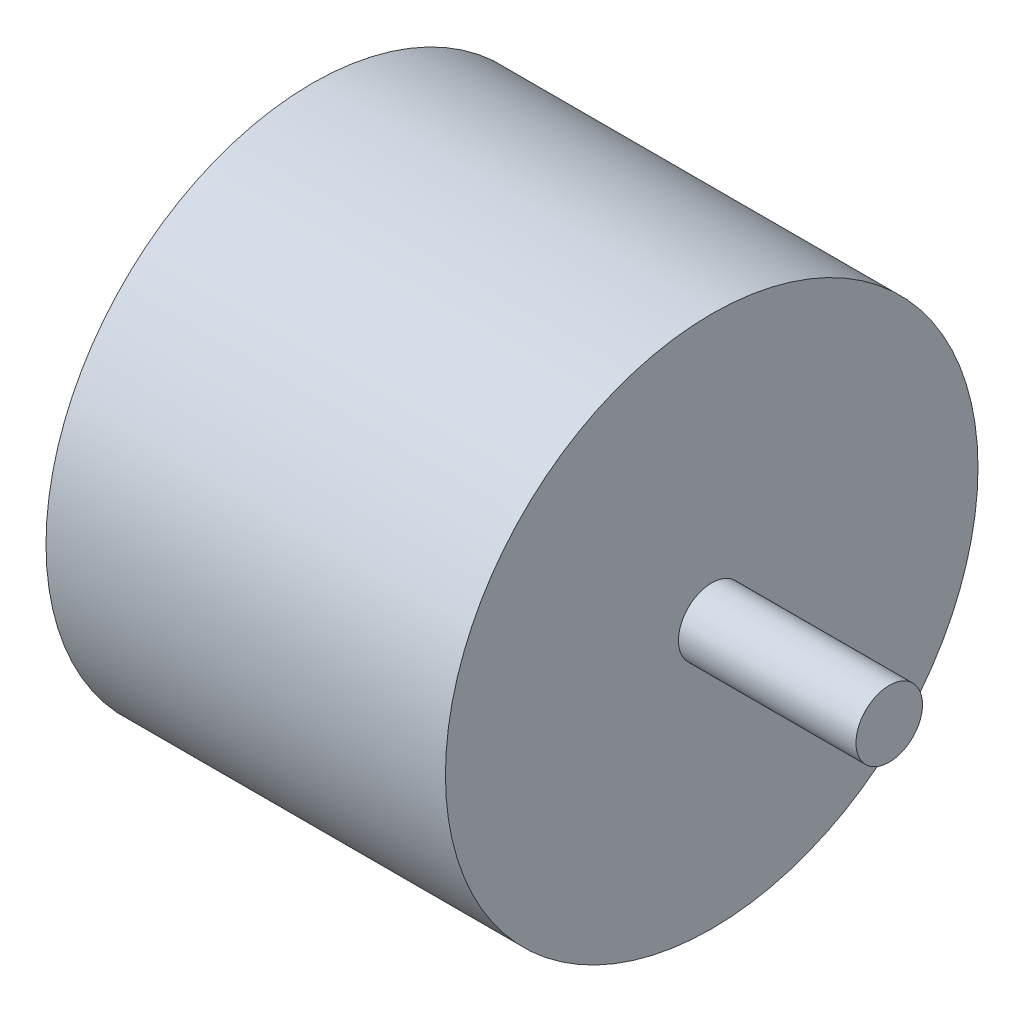
from build123d import *

# Parameters (mm, degrees)
SKETCH_1_R      = 12
EXTRUDE_1_DEPTH = 18
SKETCH_2_R      = 1.5
EXTRUDE_2_DEPTH = 8


with BuildPart() as part:
    # 草图1 → 凸台-拉伸1 (new body)
    with BuildSketch(Plane(origin=(0, 0, 0), x_dir=(0, 0, -1), z_dir=(1, 0, 0))):
        Circle(SKETCH_1_R)
    extrude(amount=EXTRUDE_1_DEPTH)

    # 草图2 → 凸台-拉伸2 (add)
    with BuildSketch(Plane(origin=(18, 0, 0), x_dir=(0, 0, -1), z_dir=(1, 0, 0))):
        Circle(SKETCH_2_R)
    extrude(amount=EXTRUDE_2_DEPTH)


solid = part.part
